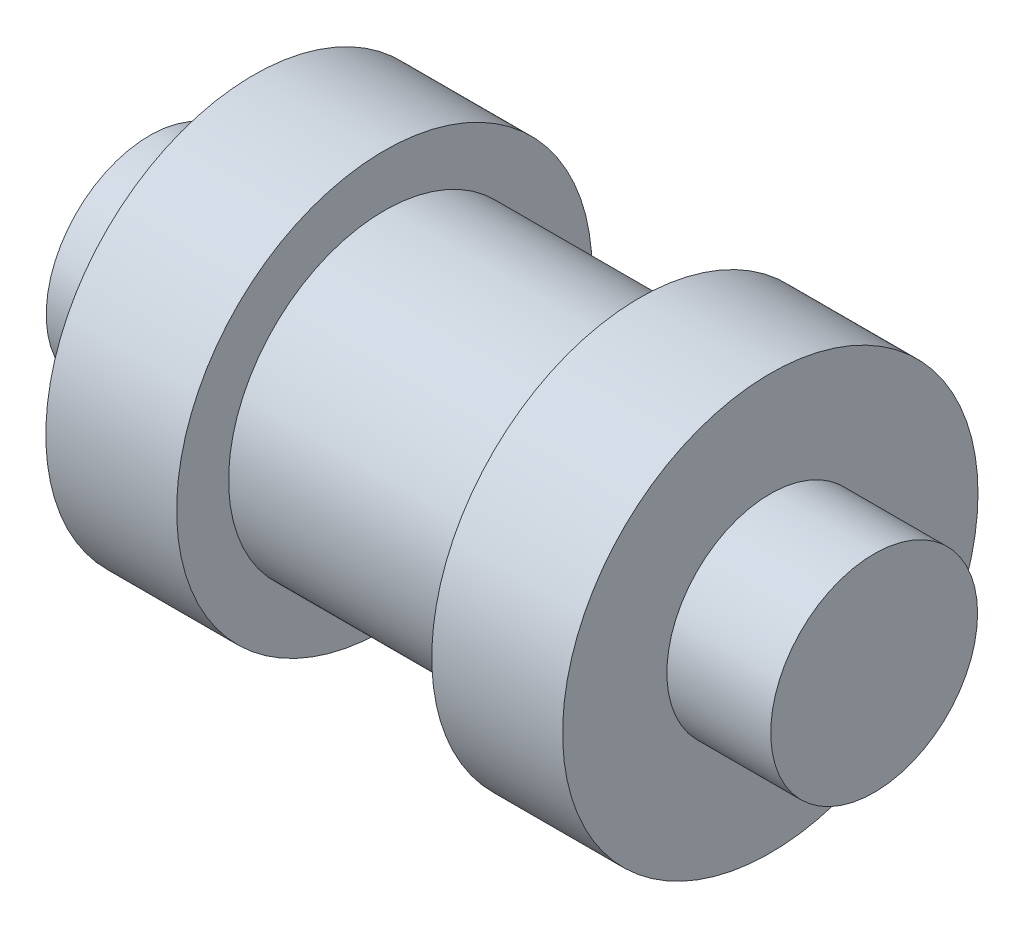
from build123d import *


with BuildPart() as part:
    # Sketch1 → Revolve1 (revolve)
    with BuildSketch(Plane.XY, mode=Mode.PRIVATE) as revolve1_sk:
        Polygon((5.5375, 0), (-5.5375, 0), (-5.5375, 1.58115), (-3.95, 1.58115), (-3.95, 3.175), (-1.95, 3.175), (-1.95, 2.38125), (1.95, 2.38125), (1.95, 3.175), (3.95, 3.175), (3.95, 1.58115), (5.5375, 1.58115), align=None)
    revolve(revolve1_sk.sketch.rotate(Axis((11.797676621, 0, 0), (-1, 0, 0)), 90), axis=Axis((11.797676621, 0, 0), (-1, 0, 0)))


solid = part.part
